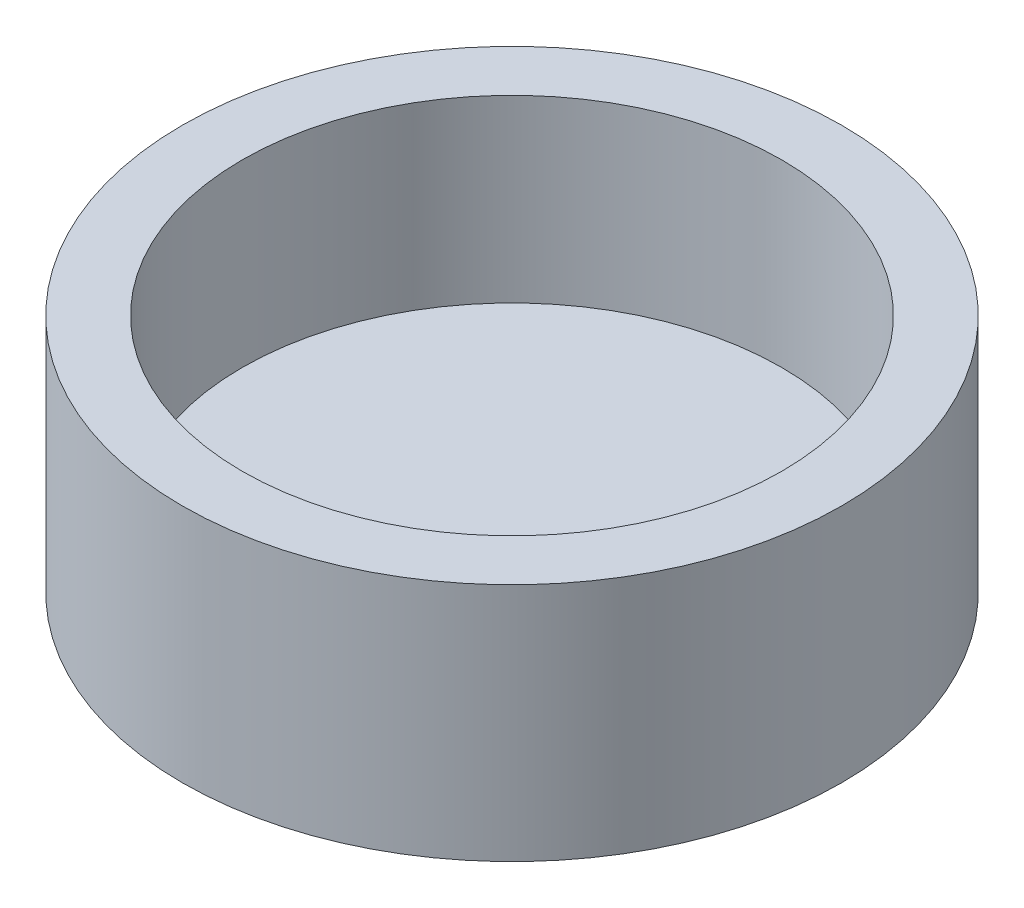
from build123d import *

# Parameters (mm, degrees)
SKETCH1_R           = 5.5
BOSS_EXTRUDE1_DEPTH = 4
SKETCH2_R           = 4.5
CUT_EXTRUDE1_DEPTH  = 3


with BuildPart() as part:
    # Sketch1 → Boss-Extrude1 (new body)
    with BuildSketch(Plane(origin=(0, 0, 0), x_dir=(1, 0, 0), z_dir=(0, 1, 0))):
        Circle(SKETCH1_R)
    extrude(amount=BOSS_EXTRUDE1_DEPTH)

    # Sketch2 → Cut-Extrude1 (cut)
    with BuildSketch(Plane(origin=(0, 4, 0), x_dir=(-1, 0, 0), z_dir=(0, 1, 0))):
        Circle(SKETCH2_R)
    extrude(amount=-CUT_EXTRUDE1_DEPTH, mode=Mode.SUBTRACT)


solid = part.part
